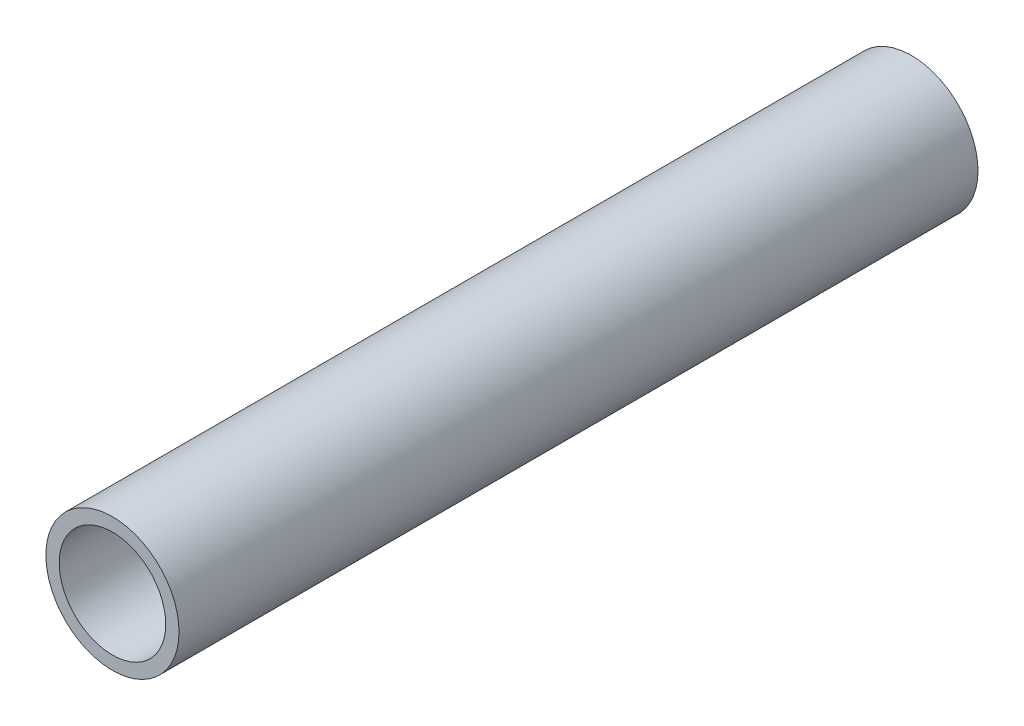
from build123d import *

# Parameters (mm, degrees)
ESBO_O1_R                = 12.5
ESBO_O1_R_2              = 10
RESSALTO_EXTRUS_O1_DEPTH = 150


with BuildPart() as part:
    # Esboço1 → Ressalto-extrusão1 (new body)
    with BuildSketch(Plane.XY):
        Circle(ESBO_O1_R)
        Circle(ESBO_O1_R_2, mode=Mode.SUBTRACT)
    extrude(amount=RESSALTO_EXTRUS_O1_DEPTH)


solid = part.part
